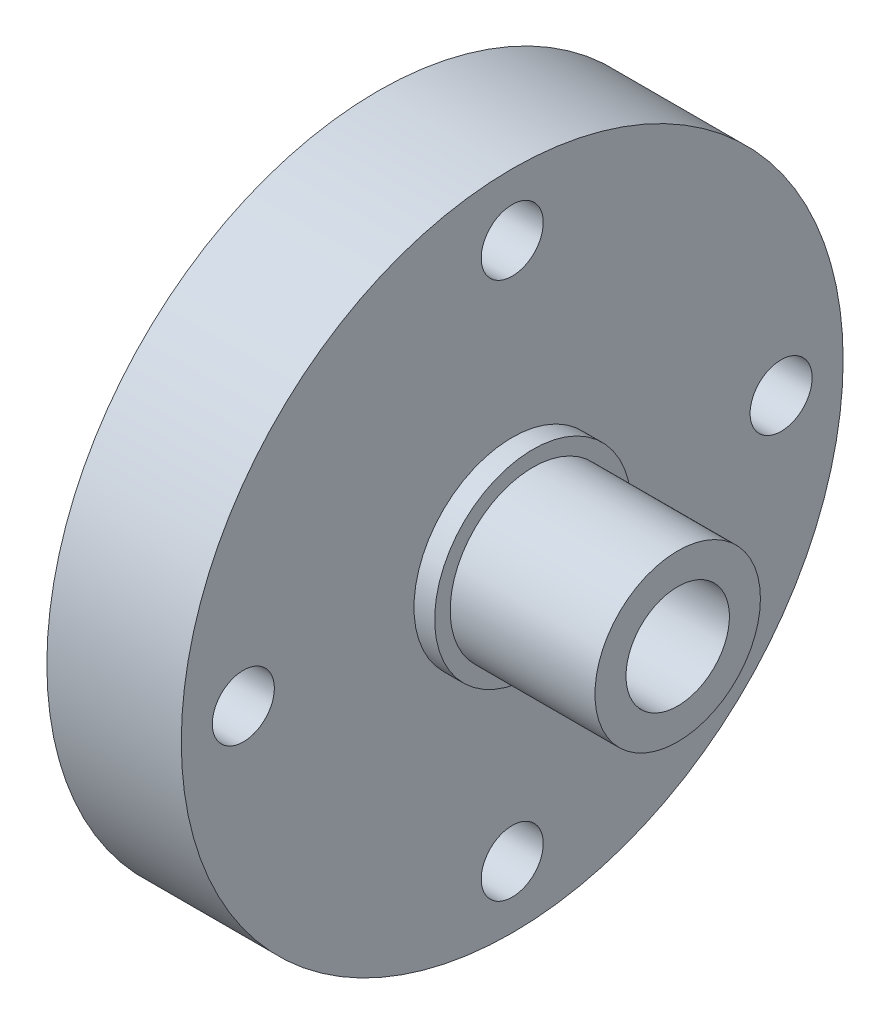
from build123d import *

# Parameters (mm, degrees)
SKETCH1_R           = 16
SKETCH1_R_2         = 2.5
BOSS_EXTRUDE1_DEPTH = 6.5
SKETCH2_R           = 1.5
CUT_EXTRUDE1_DEPTH  = 24.542514734
SKETCH4_R           = 4.75
SKETCH4_R_2         = 2.5
BOSS_EXTRUDE2_DEPTH = 1
SKETCH5_R           = 4
SKETCH5_R_2         = 2.5
BOSS_EXTRUDE3_DEPTH = 7


with BuildPart() as part:
    # Sketch1 → Boss-Extrude1 (new body)
    with BuildSketch(Plane(origin=(0, 0, 0), x_dir=(0, 0, -1), z_dir=(1, 0, 0))):
        with Locations(Location((0, 0, 0), (0, 0, 180))):
            Circle(SKETCH1_R)
        with Locations(Location((0, 0, 0), (0, 0, 180))):
            Circle(SKETCH1_R_2, mode=Mode.SUBTRACT)
    extrude(amount=BOSS_EXTRUDE1_DEPTH)

    # Sketch2 → Cut-Extrude1 (cut, through all)
    with BuildSketch(Plane(origin=(6.5, 0, 0), x_dir=(0, 0, -1), z_dir=(1, 0, 0))):
        with Locations((0, 13)):
            Circle(SKETCH2_R)
        with Locations((13, 0)):
            Circle(SKETCH2_R)
        with Locations((0, -13)):
            Circle(SKETCH2_R)
        with Locations((-13, 0)):
            Circle(SKETCH2_R)
    extrude(amount=-CUT_EXTRUDE1_DEPTH, mode=Mode.SUBTRACT)

    # Sketch4 → Boss-Extrude2 (add)
    with BuildSketch(Plane(origin=(6.5, 0, 0), x_dir=(0, 0, -1), z_dir=(1, 0, 0))):
        Circle(SKETCH4_R)
        with Locations(Location((0, 0, 0), (0, 0, 180))):
            Circle(SKETCH4_R_2, mode=Mode.SUBTRACT)
    extrude(amount=BOSS_EXTRUDE2_DEPTH)

    # Sketch5 → Boss-Extrude3 (add)
    with BuildSketch(Plane(origin=(7.5, 0, 0), x_dir=(0, 0, -1), z_dir=(1, 0, 0))):
        Circle(SKETCH5_R)
        with Locations(Location((0, 0, 0), (0, 0, 180))):
            Circle(SKETCH5_R_2, mode=Mode.SUBTRACT)
    extrude(amount=BOSS_EXTRUDE3_DEPTH)


solid = part.part
